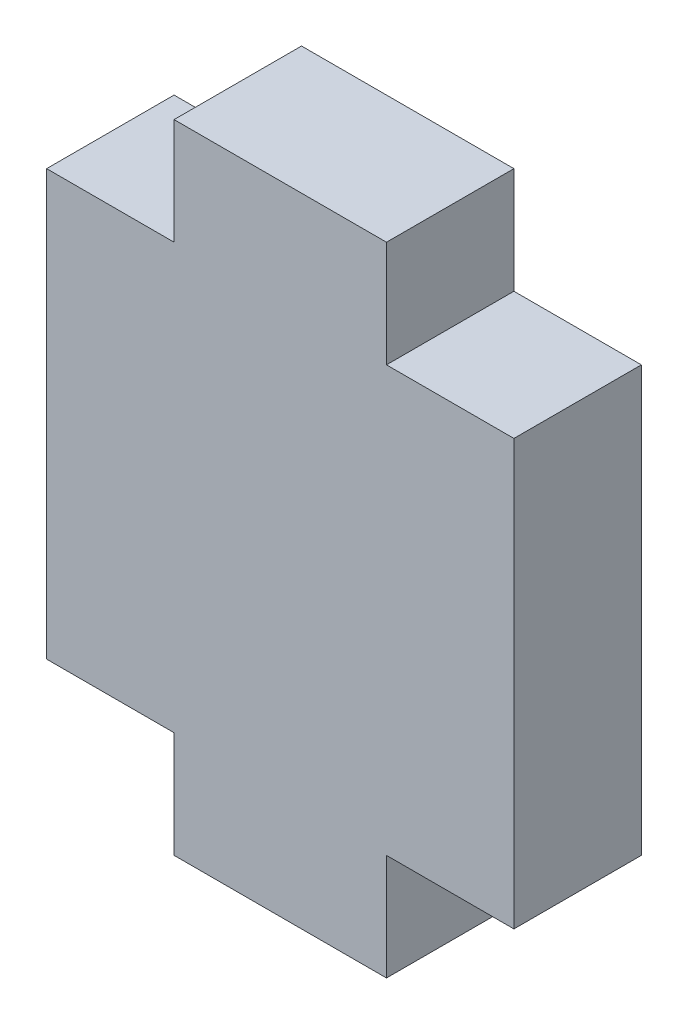
from build123d import *

# Parameters (mm, degrees)
SKETCH_1_W      = 3
SKETCH_1_H      = 10
SKETCH_1_W_2    = 5
SKETCH_1_H_2    = 15
EXTRUDE_1_DEPTH = 3


with BuildPart() as part:
    # 草图1 → 凸台-拉伸1 (new body)
    with BuildSketch(Plane.XY):
        with Locations((-4, 0)):
            Rectangle(SKETCH_1_W, SKETCH_1_H)
        Rectangle(SKETCH_1_W_2, SKETCH_1_H_2)
        with Locations((4, 0)):
            Rectangle(SKETCH_1_W, SKETCH_1_H)
    extrude(amount=EXTRUDE_1_DEPTH)


solid = part.part
